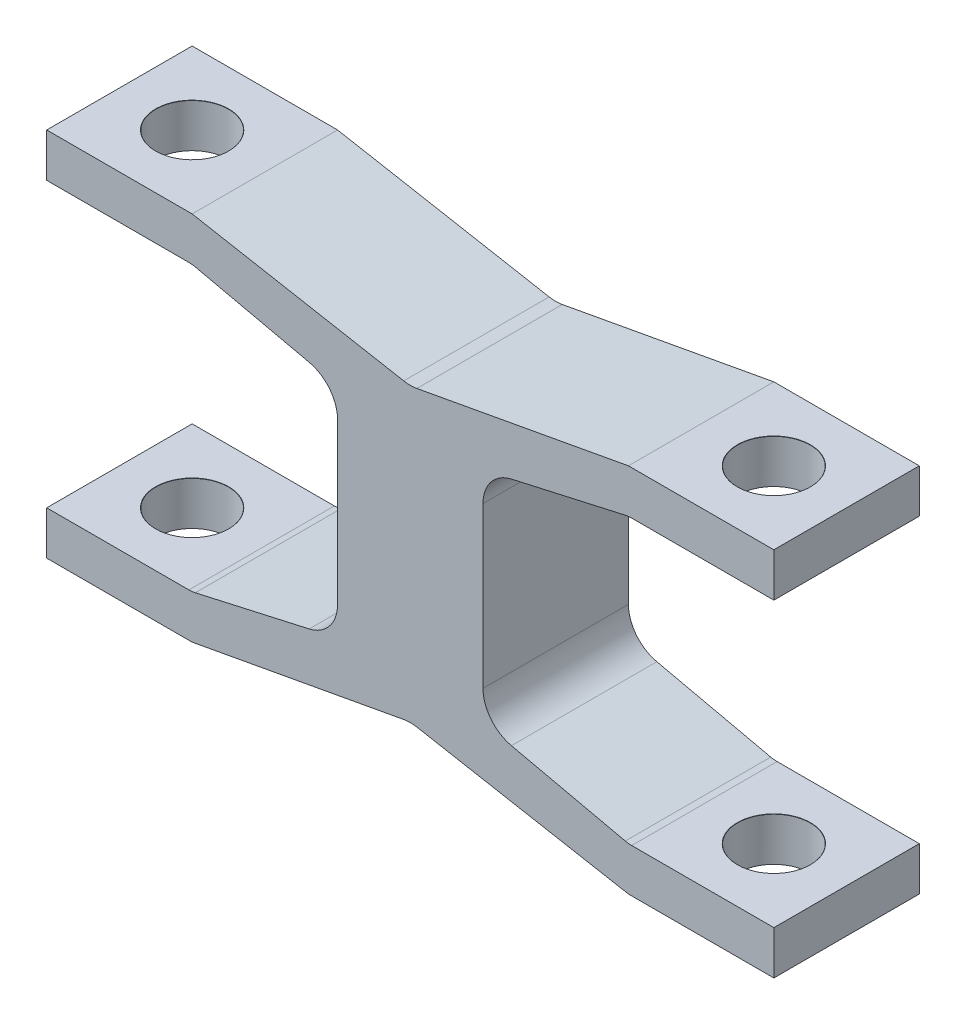
from build123d import *

# Parameters (mm, degrees)
BOSS_EXTRUDE1_DEPTH                        = 10
FILLET1_R                                  = 5
F_10_0MM_DOWEL_HOLE1_D                     = 10
F_10_0MM_DOWEL_HOLE1_DEPTH                 = 24.5
F_10_0MM_DOWEL_HOLE1_CSINK_D               = 10.05
F_10_0MM_DOWEL_HOLE1_CSINK_ANGLE           = 90
F_10_0MM_DOWEL_HOLE1_TIP                   = 3.004303095
F_10_0MM_DOWEL_HOLE1_ON_FACE_2_D           = 10
F_10_0MM_DOWEL_HOLE1_ON_FACE_2_DEPTH       = 24.5
F_10_0MM_DOWEL_HOLE1_ON_FACE_2_CSINK_D     = 10.05
F_10_0MM_DOWEL_HOLE1_ON_FACE_2_CSINK_ANGLE = 90
F_10_0MM_DOWEL_HOLE1_ON_FACE_2_TIP         = 3.004303095
FILLET2_R                                  = 4


with BuildPart() as part:
    # Sketch1 → Boss-Extrude1 (new, symmetric)
    with BuildSketch(Plane.XY):
        Polygon((-50, 19.5), (-50, 25.5), (-30, 25.5), (0, 20), (30, 25.5), (50, 25.5), (50, 19.5), (30, 19.5), (10, 15), (10, -15), (30, -19.5), (50, -19.5), (50, -25.5), (30, -25.5), (0, -20), (-30, -25.5), (-50, -25.5), (-50, -19.5), (-30, -19.5), (-10, -15), (-10, 15), (-30, 19.5), align=None)
    extrude(amount=BOSS_EXTRUDE1_DEPTH, both=True)

    # Fillet1
    fillet1_edges = [part.edges().sort_by_distance(p)[0] for p in [
        (-10, 15, 0),
        (0, 20, 0),
        (10, 15, 0),
        (10, -15, 0),
        (0, -20, 0),
        (-10, -15, 0),
    ]]
    fillet(fillet1_edges, radius=FILLET1_R)

    # Ø10.0mm Dowel Hole1
    with Locations(Plane(origin=(-40, 25.5, 0), x_dir=(0, 0, 1), z_dir=(0, 1, 0))):
        with Locations((0, 0), (0, 80)):
            CounterSinkHole(F_10_0MM_DOWEL_HOLE1_D / 2, F_10_0MM_DOWEL_HOLE1_CSINK_D / 2, depth=F_10_0MM_DOWEL_HOLE1_DEPTH, counter_sink_angle=F_10_0MM_DOWEL_HOLE1_CSINK_ANGLE)
            with Locations((0, 0, -(F_10_0MM_DOWEL_HOLE1_DEPTH + F_10_0MM_DOWEL_HOLE1_TIP / 2))):  # 118° drill point
                Cone(0, F_10_0MM_DOWEL_HOLE1_D / 2, F_10_0MM_DOWEL_HOLE1_TIP, mode=Mode.SUBTRACT)

    # Ø10.0mm Dowel Hole1 on face 2
    with Locations(Plane(origin=(-40, -19.5, 0), x_dir=(0, 0, 1), z_dir=(0, 1, 0))):
        with Locations((0, 0), (0, 80)):
            CounterSinkHole(F_10_0MM_DOWEL_HOLE1_ON_FACE_2_D / 2, F_10_0MM_DOWEL_HOLE1_ON_FACE_2_CSINK_D / 2, depth=F_10_0MM_DOWEL_HOLE1_ON_FACE_2_DEPTH, counter_sink_angle=F_10_0MM_DOWEL_HOLE1_ON_FACE_2_CSINK_ANGLE)
            with Locations((0, 0, -(F_10_0MM_DOWEL_HOLE1_ON_FACE_2_DEPTH + F_10_0MM_DOWEL_HOLE1_ON_FACE_2_TIP / 2))):  # 118° drill point
                Cone(0, F_10_0MM_DOWEL_HOLE1_ON_FACE_2_D / 2, F_10_0MM_DOWEL_HOLE1_ON_FACE_2_TIP, mode=Mode.SUBTRACT)

    # Fillet2
    fillet2_edges = [part.edges().sort_by_distance(p)[0] for p in [
        (-30, 19.5, 0),
        (30, 19.5, 0),
        (30, -19.5, 0),
        (-30, -19.5, 0),
    ]]
    fillet(fillet2_edges, radius=FILLET2_R)


solid = part.part
